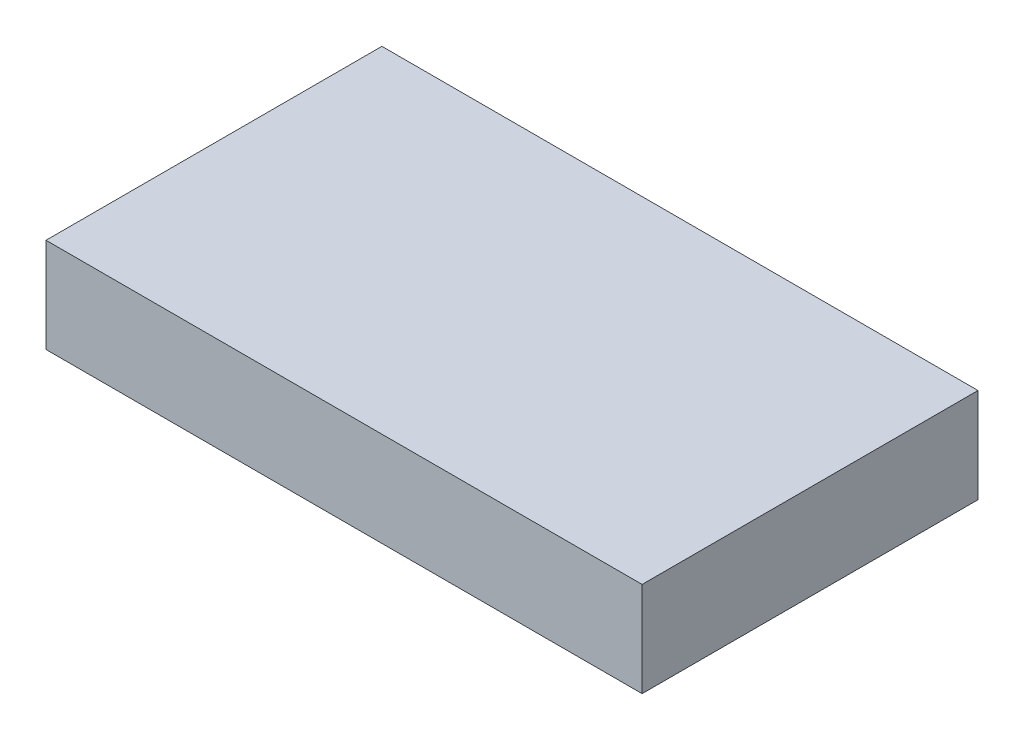
from build123d import *

# Parameters (mm, degrees)
SKETCH1_W           = 126
SKETCH1_H           = 71
BOSS_EXTRUDE1_DEPTH = 20


with BuildPart() as part:
    # Sketch1 → Boss-Extrude1 (new body)
    with BuildSketch(Plane(origin=(0, 0, 0), x_dir=(1, 0, 0), z_dir=(0, 1, 0))):
        Rectangle(SKETCH1_W, SKETCH1_H)
    extrude(amount=BOSS_EXTRUDE1_DEPTH)


solid = part.part
